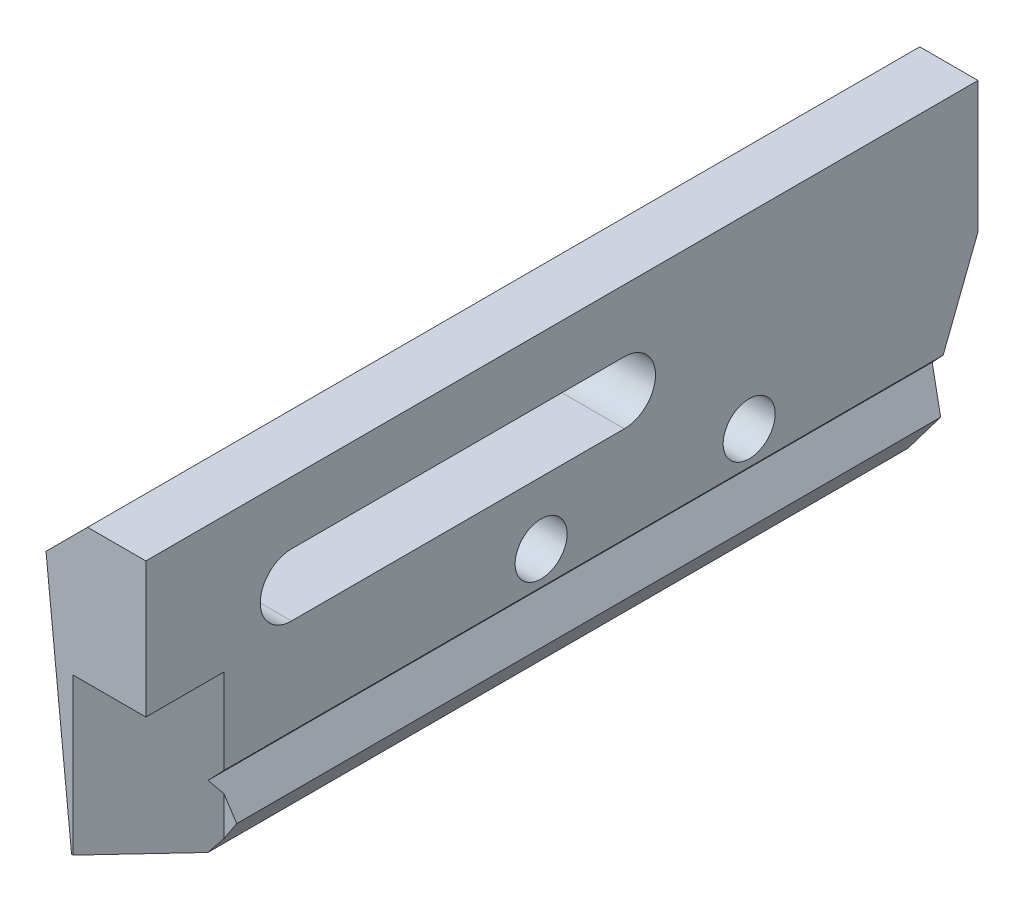
from build123d import *

# Parameters (mm, degrees)
BOSS_EXTRU_1_DEPTH           = 40
ENL_V_MAT_EXTRU_1_DEPTH      = 43.650205158
ENL_V_MAT_EXTRU_1_DEPTH_BACK = 43.650205158
ENL_V_MAT_EXTRU_3_DEPTH      = 40
TROU_TARAUD_M31_D            = 2.5
TROU_TARAUD_M31_DEPTH        = 8.5
TROU_TARAUD_M31_TIP          = 0.751075774
ENL_V_MAT_EXTRU_4_DEPTH      = 3.6


with BuildPart() as part:
    # Esquisse1 → Boss.-Extru.1 (new body)
    with BuildSketch(Plane.XY):
        Polygon((0, -2), (2, 0), (4.8, 0), (4.8, -10.6), (4.43, -11), (5.42, -12.5), (4.43, -14), (1.23, -14), align=None)
    extrude(amount=BOSS_EXTRU_1_DEPTH)

    # Esquisse2 → Enlèv. mat.-Extru.1 (cut, two sides: drawn at the far end of the back side and taken through both)
    with BuildSketch(Plane(origin=(4.8, 0, 0), x_dir=(0, 0, -1), z_dir=(1, 0, 0)).offset(-ENL_V_MAT_EXTRU_1_DEPTH_BACK)):
        Polygon((0, -14), (0, -6.3), (-3, -14), align=None)
    extrude(amount=ENL_V_MAT_EXTRU_1_DEPTH + ENL_V_MAT_EXTRU_1_DEPTH_BACK, mode=Mode.SUBTRACT)

    # Esquisse3 → Enlèv. mat.-Extru.3 (cut)
    with BuildSketch(Plane(origin=(0, -6.5, 0), x_dir=(-1, 0, 0), z_dir=(0, 1, 0))):
        Polygon((-6.8, 40), (-1.3, 40), (-4.8, 36.25), (-6.8, 36.25), align=None)
    extrude(amount=-ENL_V_MAT_EXTRU_3_DEPTH, mode=Mode.SUBTRACT)

    # Trou taraudé M31
    with Locations(Plane(origin=(4.8, 0, 0), x_dir=(0, 0, -1), z_dir=(1, 0, 0))):
        with Locations((-11, -9), (-21, -9)):
            Hole(TROU_TARAUD_M31_D / 2, depth=TROU_TARAUD_M31_DEPTH)
            with Locations((0, 0, -(TROU_TARAUD_M31_DEPTH + TROU_TARAUD_M31_TIP / 2))):  # 118° drill point
                Cone(0, TROU_TARAUD_M31_D / 2, TROU_TARAUD_M31_TIP, mode=Mode.SUBTRACT)

    # Esquisse6 → Enlèv. mat.-Extru.4 (cut)
    with BuildSketch(Plane(origin=(4.8, 0, 0), x_dir=(0, 0, -1), z_dir=(1, 0, 0))):
        with BuildLine():
            Line((-33, -3), (-17, -3))
            ThreePointArc((-17, -3), (-15.5, -4.5), (-17, -6))
            Line((-17, -6), (-33, -6))
            ThreePointArc((-33, -6), (-34.5, -4.5), (-33, -3))
        make_face()
    extrude(amount=-ENL_V_MAT_EXTRU_4_DEPTH, mode=Mode.SUBTRACT)


solid = part.part
